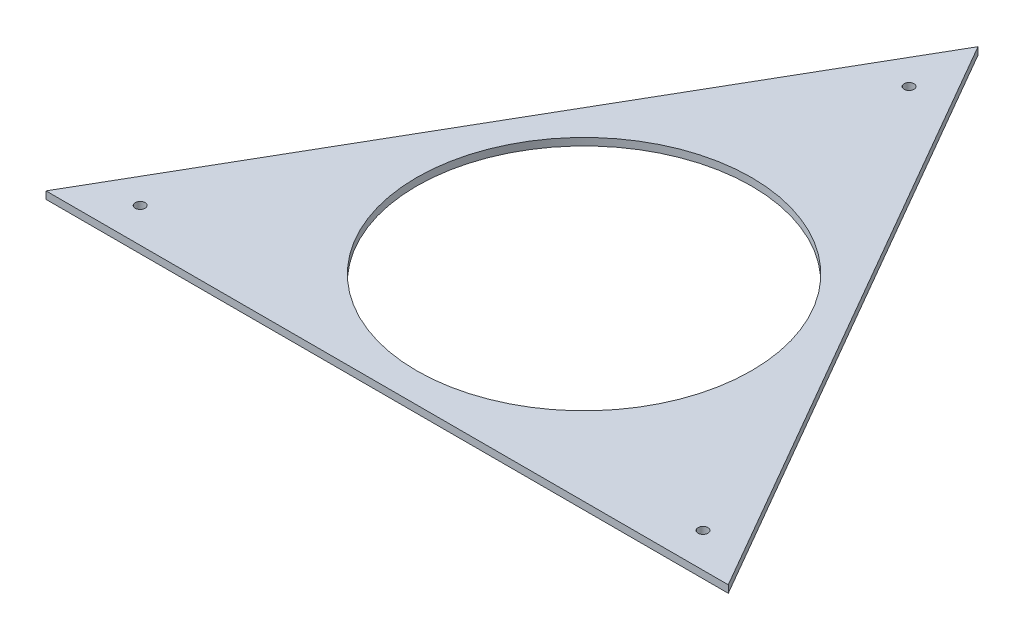
from build123d import *

# Parameters (mm, degrees)
BOSS_EXTRUDE1_DEPTH     = 4.7625
CUT_EXTRUDE3_DEPTH      = 4.7625
CUT_EXTRUDE3_DEPTH_BACK = 4.7625
SKETCH5_R               = 107.95
SKETCH6_R               = 3.175
CUT_EXTRUDE5_DEPTH      = 4.7625


with BuildPart() as part:
    # Sketch1 → Boss-Extrude1 (new body)
    with BuildSketch(Plane(origin=(0, 0, 0), x_dir=(1, 0, 0), z_dir=(0, 1, 0))):
        Polygon((0, 254), (-219.970452561, -127), (219.970452561, -127), align=None)
    extrude(amount=BOSS_EXTRUDE1_DEPTH)

    # Sketch5 → Cut-Extrude3 (cut, two sides: drawn at the far end of the back side and taken through both)
    with BuildSketch(Plane(origin=(0, 0, 0), x_dir=(1, 0, 0), z_dir=(0, 1, 0)).offset(-CUT_EXTRUDE3_DEPTH_BACK)):
        Circle(SKETCH5_R)
    extrude(amount=CUT_EXTRUDE3_DEPTH + CUT_EXTRUDE3_DEPTH_BACK, mode=Mode.SUBTRACT)

    # Sketch6 → Cut-Extrude5 (cut)
    with BuildSketch(Plane(origin=(0, 0, 0), x_dir=(1, 0, 0), z_dir=(0, 1, 0))):
        with Locations((-181.475623363, -104.775)):
            Circle(SKETCH6_R)
        with Locations((0, 209.55)):
            Circle(SKETCH6_R)
    cut_extrude5 = extrude(amount=CUT_EXTRUDE5_DEPTH, mode=Mode.SUBTRACT)

    # Mirror1: Cut-Extrude5 across plane
    add(cut_extrude5.mirror(Plane(origin=(0, 0, 0), x_dir=(0, 0, 1), z_dir=(1, 0, 0))), mode=Mode.SUBTRACT)


solid = part.part
